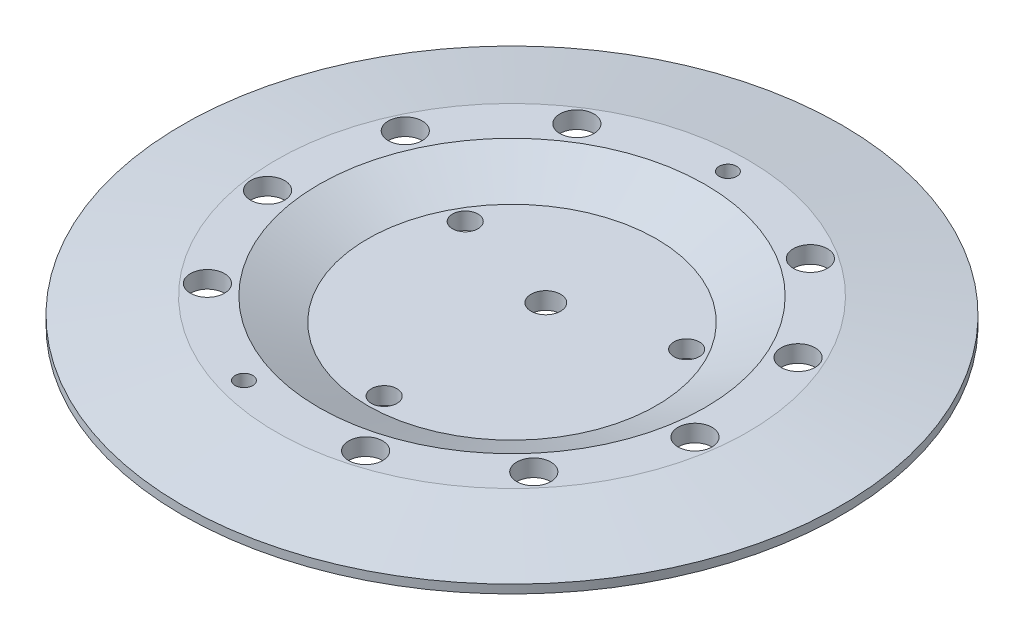
from build123d import *

# Parameters (mm, degrees)
SKETCH_3_R          = 1.55
CUT_EXTRUDE_3_DEPTH = 83.322536404
SKETCH_4_R          = 3
CUT_EXTRUDE_5_DEPTH = 83.121860671
SKETCH_5_R          = 2.25
SKETCH_5_R_2        = 2.6
CUT_EXTRUDE_6_DEPTH = 83.322536404


with BuildPart() as part:
    # 草图1 → 旋转2 (revolve)
    with BuildSketch(Plane.XY, mode=Mode.PRIVATE) as revolve_2_sk:
        Polygon((25.421972318, 0), (34, 4), (41.5, 4), (56.009758155, 1.441538154), (58, 2.590604818), (58, 4.090604818), (41.5, 7), (34, 7), (25.421972318, 3), (0, 3), (0, 0), align=None)
    revolve(revolve_2_sk.sketch.rotate(Axis((0, 0, 0), (0, 1, 0)), 90), axis=Axis((0, 0, 0), (0, 1, 0)))

    # 草图3 → 切除-拉伸3 (cut, through all)
    with BuildSketch(Plane(origin=(0, 7, 0), x_dir=(1, 0, 0), z_dir=(0, 1, 0))):
        with Locations(Location((0, 38, 0), (0, 0, 270))):
            Circle(SKETCH_3_R)
        with Locations(Location((20.544351063, 31.967634248, 0), (0, 0, 270))):
            Circle(SKETCH_3_R)
        with Locations(Location((34.566015823, 15.785770494, 0), (0, 0, 270))):
            Circle(SKETCH_3_R)
        with Locations(Location((37.613214791, -5.407963854, 0), (0, 0, 270))):
            Circle(SKETCH_3_R)
        with Locations(Location((28.718483825, -24.88470789, 0), (0, 0, 270))):
            Circle(SKETCH_3_R)
        with Locations(Location((10.70583716, -36.460732997, 0), (0, 0, 270))):
            Circle(SKETCH_3_R)
        with Locations(Location((-10.70583716, -36.460732997, 0), (0, 0, 270))):
            Circle(SKETCH_3_R)
        with Locations(Location((-28.718483825, -24.88470789, 0), (0, 0, 270))):
            Circle(SKETCH_3_R)
        with Locations(Location((-37.613214791, -5.407963854, 0), (0, 0, 270))):
            Circle(SKETCH_3_R)
        with Locations(Location((-34.566015823, 15.785770494, 0), (0, 0, 270))):
            Circle(SKETCH_3_R)
        with Locations(Location((-20.544351063, 31.967634248, 0), (0, 0, 270))):
            Circle(SKETCH_3_R)
    extrude(amount=-CUT_EXTRUDE_3_DEPTH, mode=Mode.SUBTRACT)

    # 草图4 → 切除-拉伸5 (cut, through all)
    with BuildSketch(Plane.XZ.offset(-4)):
        with Locations((10.70583716, 36.460732997)):
            Circle(SKETCH_4_R)
        with Locations((28.718483825, 24.88470789)):
            Circle(SKETCH_4_R)
        with Locations((37.613214791, 5.407963854)):
            Circle(SKETCH_4_R)
        with Locations((-28.718483825, 24.88470789)):
            Circle(SKETCH_4_R)
        with Locations((-34.566015823, -15.785770494)):
            Circle(SKETCH_4_R)
        with Locations((-20.544351063, -31.967634248)):
            Circle(SKETCH_4_R)
        with Locations((20.544351063, -31.967634248)):
            Circle(SKETCH_4_R)
        with Locations((34.566015823, -15.785770494)):
            Circle(SKETCH_4_R)
        with Locations((-37.613214791, 5.407963854)):
            Circle(SKETCH_4_R)
    extrude(amount=-CUT_EXTRUDE_5_DEPTH, mode=Mode.SUBTRACT)

    # 草图5 → 切除-拉伸6 (cut, through all)
    with BuildSketch(Plane.XZ):
        with Locations((-19.485571585, -11.25)):
            Circle(SKETCH_5_R)
        with Locations((19.485571585, -11.25)):
            Circle(SKETCH_5_R)
        with Locations((0, 22.5)):
            Circle(SKETCH_5_R)
        with Locations((0, -5.95)):
            Circle(SKETCH_5_R_2)
    extrude(amount=-CUT_EXTRUDE_6_DEPTH, mode=Mode.SUBTRACT)


solid = part.part
